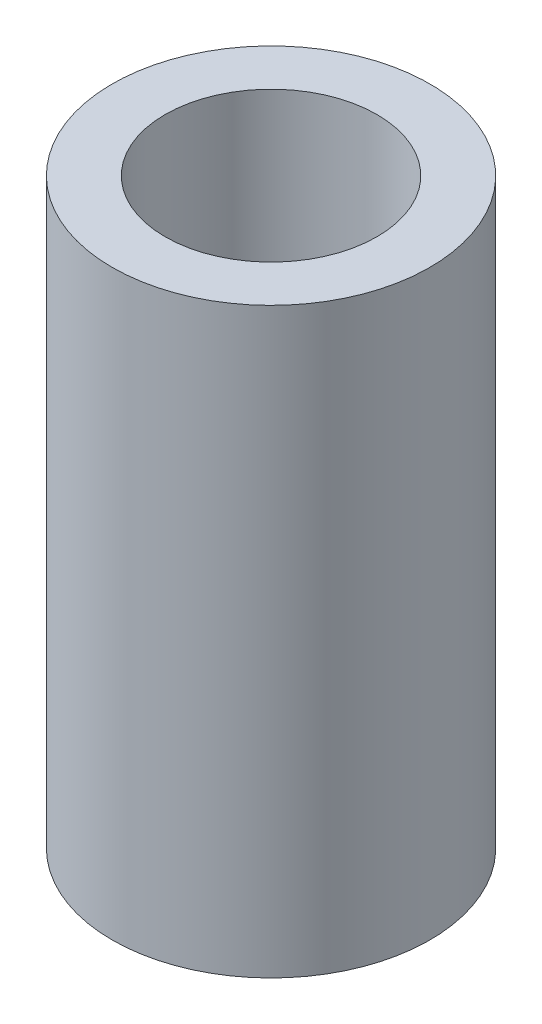
from build123d import *

# Parameters (mm, degrees)
SKETCH1_W = 1
SKETCH1_H = 11


with BuildPart() as part:
    # Sketch1 → Revolve1 (revolve)
    with BuildSketch(Plane.XY, mode=Mode.PRIVATE) as revolve1_sk:
        with Locations((-2.5, -5.5)):
            Rectangle(SKETCH1_W, SKETCH1_H)
    revolve(revolve1_sk.sketch.rotate(Axis((0, 0, 0), (0, -1, 0)), 270), axis=Axis((0, 0, 0), (0, -1, 0)))


solid = part.part
